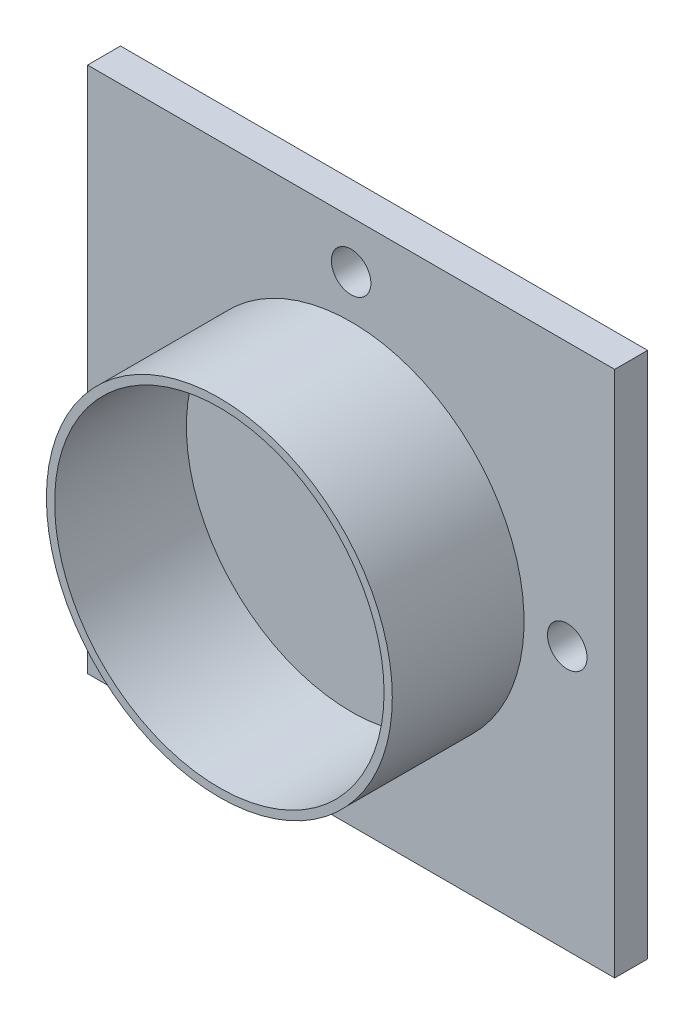
from build123d import *

# Parameters (mm, degrees)
SKETCH1_W           = 320
SKETCH1_H           = 320
BOSS_EXTRUDE1_DEPTH = 20
SKETCH2_R           = 105
SKETCH2_R_2         = 100
BOSS_EXTRUDE2_DEPTH = 80
SKETCH4_R           = 12
CUT_EXTRUDE1_DEPTH  = 333.345210486


with BuildPart() as part:
    # Sketch1 → Boss-Extrude1 (new body)
    with BuildSketch(Plane.XY):
        with Locations((120.0952319, 0)):
            Rectangle(SKETCH1_W, SKETCH1_H)
    extrude(amount=BOSS_EXTRUDE1_DEPTH)

    # Sketch2 → Boss-Extrude2 (add)
    with BuildSketch(Plane.XY.offset(20)):
        with Locations(Location((120.0952319, 0, 0), (0, 0, 180))):
            Circle(SKETCH2_R)
        with Locations((120.0952319, 0)):
            Circle(SKETCH2_R_2, mode=Mode.SUBTRACT)
    extrude(amount=BOSS_EXTRUDE2_DEPTH)

    # Sketch4 → Cut-Extrude1 (cut, through all)
    with BuildSketch(Plane.XY.offset(20)):
        with Locations((120.0952319, 131.208738881)):
            Circle(SKETCH4_R)
        with Locations((251.303970781, 0)):
            Circle(SKETCH4_R)
        with Locations((120.0952319, -131.208738881)):
            Circle(SKETCH4_R)
        with Locations((-11.113506981, 0)):
            Circle(SKETCH4_R)
    extrude(amount=-CUT_EXTRUDE1_DEPTH, mode=Mode.SUBTRACT)


solid = part.part
